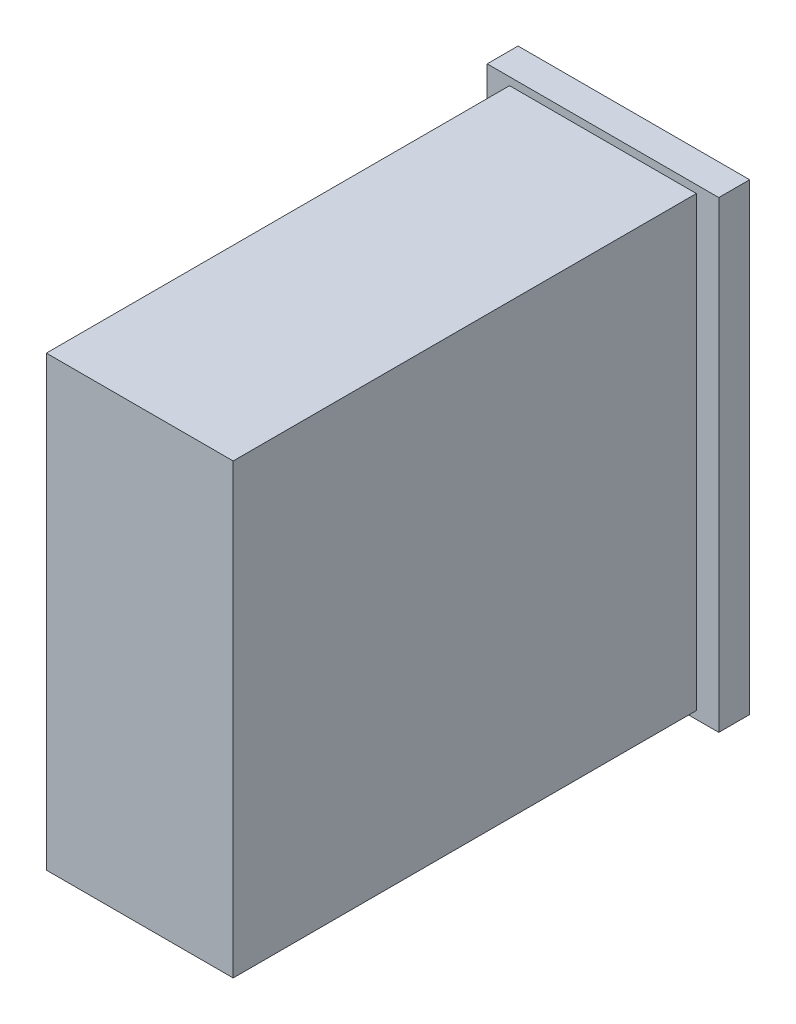
from build123d import *

# Parameters (mm, degrees)
ESQUISSE1_W        = 15
ESQUISSE1_H        = 30
BOSS_EXTRU_1_DEPTH = 2
ESQUISSE2_W        = 12.1
ESQUISSE2_H        = 29
BOSS_EXTRU_2_DEPTH = 30


with BuildPart() as part:
    # Esquisse1 → Boss.-Extru.1 (new body)
    with BuildSketch(Plane.XY):
        Rectangle(ESQUISSE1_W, ESQUISSE1_H)
    extrude(amount=BOSS_EXTRU_1_DEPTH)

    # Esquisse2 → Boss.-Extru.2 (add)
    with BuildSketch(Plane.XY.offset(2)):
        Rectangle(ESQUISSE2_W, ESQUISSE2_H)
    extrude(amount=BOSS_EXTRU_2_DEPTH)


solid = part.part
